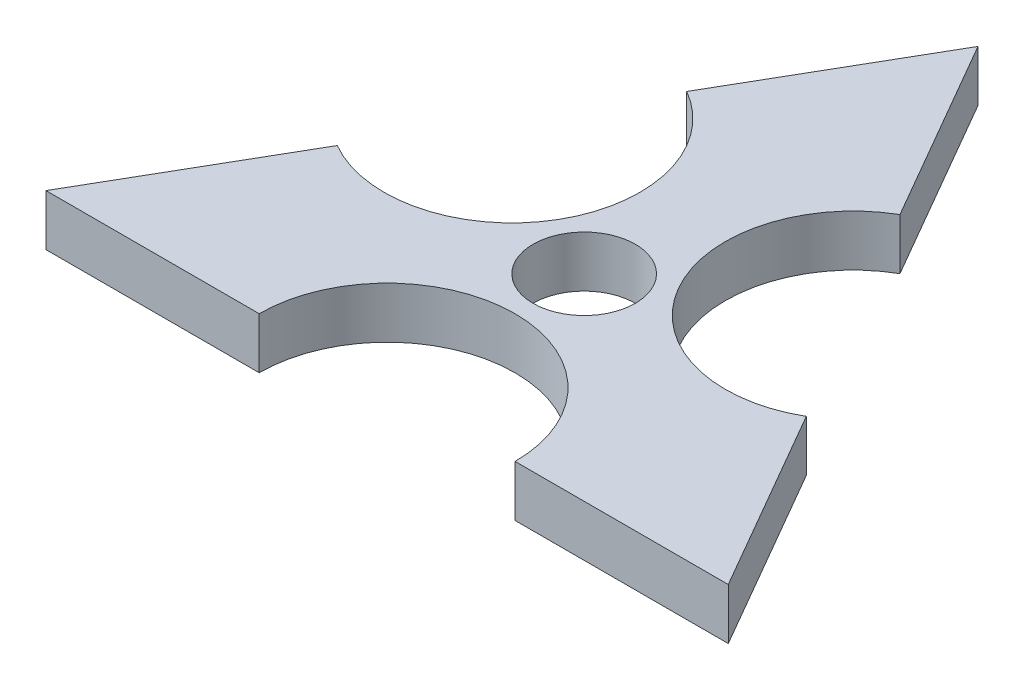
from build123d import *

# Parameters (mm, degrees)
SKETCH1_R           = 3
BOSS_EXTRUDE1_DEPTH = 3


with BuildPart() as part:
    # Sketch1 → Boss-Extrude1 (new body)
    with BuildSketch(Plane(origin=(0, 0, 0), x_dir=(1, 0, 0), z_dir=(0, 1, 0))):
        with BuildLine():
            Line((6.555052507, 23.815698604), (0.305052507, 34.641016151))
            Line((0.305052507, 34.641016151), (-5.944947493, 23.815698604))
            ThreePointArc((-5.944947493, 23.815698604), (-3.199756965, 21.070508076), (-2.194947493, 17.320508076))
            ThreePointArc((-2.194947493, 17.320508076), (-5.944947493, 10.825317547), (-13.444947493, 10.825317547))
            Line((-13.444947493, 10.825317547), (-19.694947493, 0))
            Line((-19.694947493, 0), (-7.194947493, 0))
            ThreePointArc((-7.194947493, 0), (0.305052507, 7.5), (7.805052507, 0))
            Line((7.805052507, 0), (20.305052507, 0))
            Line((20.305052507, 0), (14.055052507, 10.825317547))
            ThreePointArc((14.055052507, 10.825317547), (3.809861978, 13.570508076), (6.555052507, 23.815698604))
        make_face()
        with Locations(Location((0.305052507, 11.551965164, 0), (0, 0, 270))):
            Circle(SKETCH1_R, mode=Mode.SUBTRACT)
    extrude(amount=BOSS_EXTRUDE1_DEPTH)


solid = part.part
